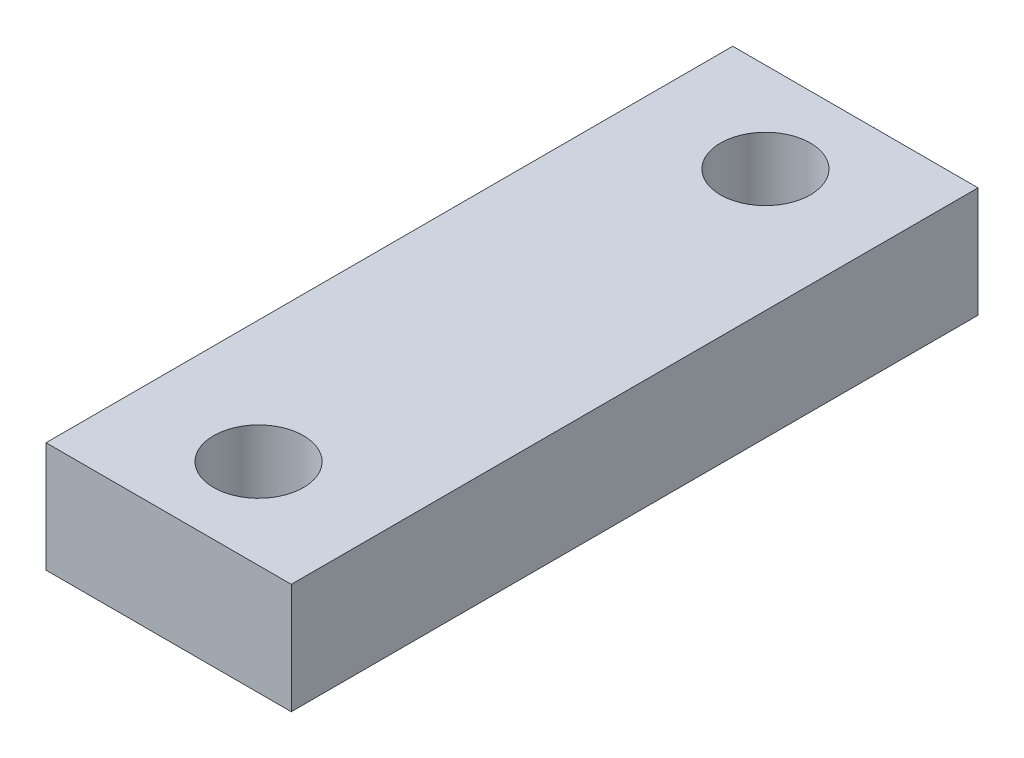
from build123d import *

# Parameters (mm, degrees)
SKETCH1_W                    = 42
SKETCH1_H                    = 6.75
PROFILEBOSS_EXTRUDE1_DEPTH   = 15
SKETCH2_R                    = 2.75
MOUNTHOLESCUT_EXTRUDE1_DEPTH = 46.106124861


with BuildPart() as part:
    # Sketch1 → ProfileBoss-Extrude1 (new body)
    with BuildSketch(Plane(origin=(0, 0, 0), x_dir=(0, 0, -1), z_dir=(1, 0, 0))):
        with Locations((21, 3.375)):
            Rectangle(SKETCH1_W, SKETCH1_H)
    extrude(amount=PROFILEBOSS_EXTRUDE1_DEPTH)

    # Sketch2 → MountHolesCut-Extrude1 (cut, through all)
    with BuildSketch(Plane(origin=(0, 6.75, 0), x_dir=(1, 0, 0), z_dir=(0, 1, 0))):
        with Locations(Location((7.5, 5.5, 0), (0, 0, 270))):
            Circle(SKETCH2_R)
        with Locations(Location((7.5, 36.5, 0), (0, 0, 270))):
            Circle(SKETCH2_R)
    extrude(amount=-MOUNTHOLESCUT_EXTRUDE1_DEPTH, mode=Mode.SUBTRACT)


solid = part.part
